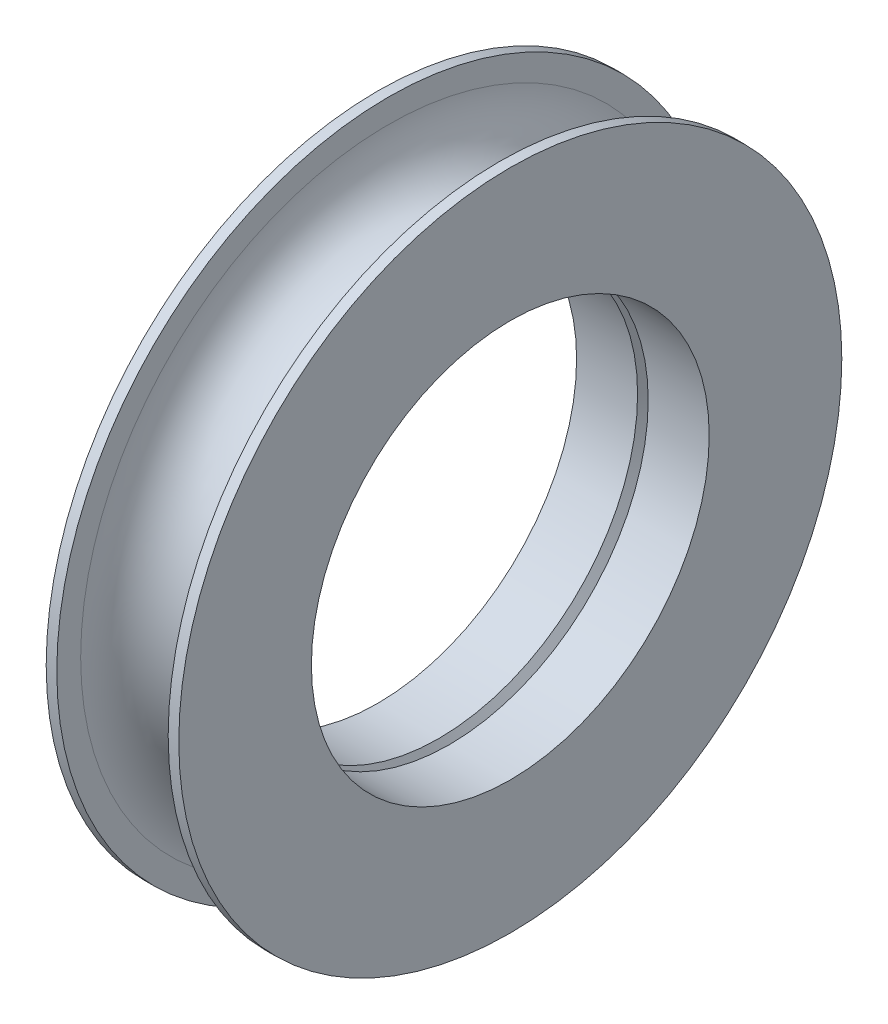
from build123d import *


with BuildPart() as part:
    # Sketch1 → Revolve1 (revolve)
    with BuildSketch(Plane.XY, mode=Mode.PRIVATE) as revolve1_sk:
        with BuildLine():
            Line((-2.5, 7.5), (-0.2, 7.5))
            Line((-0.2, 7.5), (0, 7.846410162))
            Line((0, 7.846410162), (0.2, 7.5))
            Line((0.2, 7.5), (2.5, 7.5))
            Line((2.5, 7.5), (2.5, 12.5))
            Line((2.5, 12.5), (2.1, 12.5))
            Line((2.1, 12.5), (2.1, 11.6))
            ThreePointArc((2.1, 11.6), (0, 9.5), (-2.1, 11.6))
            Line((-2.1, 11.6), (-2.1, 12.5))
            Line((-2.1, 12.5), (-2.5, 12.5))
            Line((-2.5, 12.5), (-2.5, 7.5))
        make_face()
    revolve(revolve1_sk.sketch.rotate(Axis((-2.5, 0, 0), (1, 0, 0)), 90), axis=Axis((-2.5, 0, 0), (1, 0, 0)))


solid = part.part
